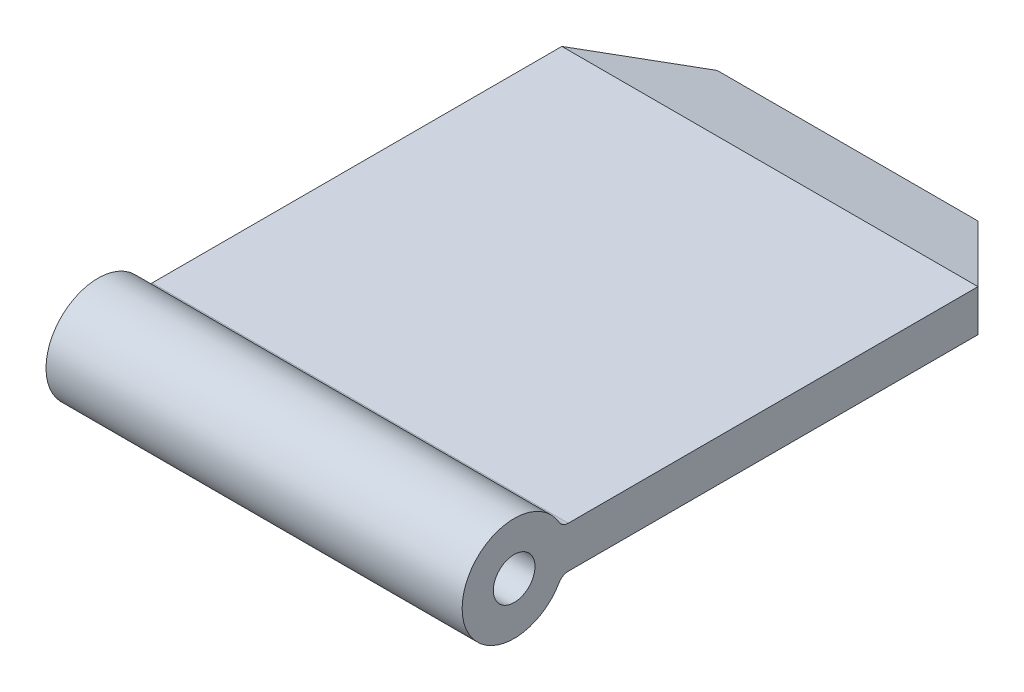
from build123d import *

# Parameters (mm, degrees)
BOSS_EXTRUDE1_DEPTH     = 101.6
SKETCH5_R               = 5.08
CUT_EXTRUDE4_DEPTH      = 168.213364787
CUT_EXTRUDE5_DEPTH      = 168.213364787
CUT_EXTRUDE5_DEPTH_BACK = 168.213364787
FILLET1_R               = 2.54


with BuildPart() as part:
    # Sketch1 → Boss-Extrude1 (new body)
    with BuildSketch(Plane(origin=(0, 0, 0), x_dir=(0, 0, -1), z_dir=(1, 0, 0))):
        with BuildLine():
            Line((11.639742265, -5.08), (113.239742265, -5.08))
            Line((113.239742265, -5.08), (132.198560368, 0))
            Line((132.198560368, 0), (113.239742265, 5.08))
            Line((113.239742265, 5.08), (11.639742265, 5.08))
            ThreePointArc((11.639742265, 5.08), (-12.7, 0), (11.639742265, -5.08))
        make_face()
    extrude(amount=BOSS_EXTRUDE1_DEPTH)

    # Sketch5 → Cut-Extrude4 (cut, through all)
    with BuildSketch(Plane(origin=(101.6, 0, 0), x_dir=(0, 0, -1), z_dir=(1, 0, 0))):
        Circle(SKETCH5_R)
    extrude(amount=-CUT_EXTRUDE4_DEPTH, mode=Mode.SUBTRACT)

    # Sketch6 → Cut-Extrude5 (cut, two sides: drawn at the far end of the back side and taken through both)
    with BuildSketch(Plane(origin=(0, 0, 0), x_dir=(1, 0, 0), z_dir=(0, 1, 0)).offset(-CUT_EXTRUDE5_DEPTH_BACK)):
        Polygon((0, 132.198560368), (0, 113.239742265), (18.958818102, 132.198560368), align=None)
        Polygon((101.6, 132.198560368), (101.6, 113.239742265), (82.641181898, 132.198560368), align=None)
    extrude(amount=CUT_EXTRUDE5_DEPTH + CUT_EXTRUDE5_DEPTH_BACK, mode=Mode.SUBTRACT)

    # Fillet1
    fillet1_edges = [part.edges().sort_by_distance(p)[0] for p in [
        (50.8, 5.08, -11.639742265),
        (50.8, -5.08, -11.639742265),
    ]]
    fillet(fillet1_edges, radius=FILLET1_R)


solid = part.part
